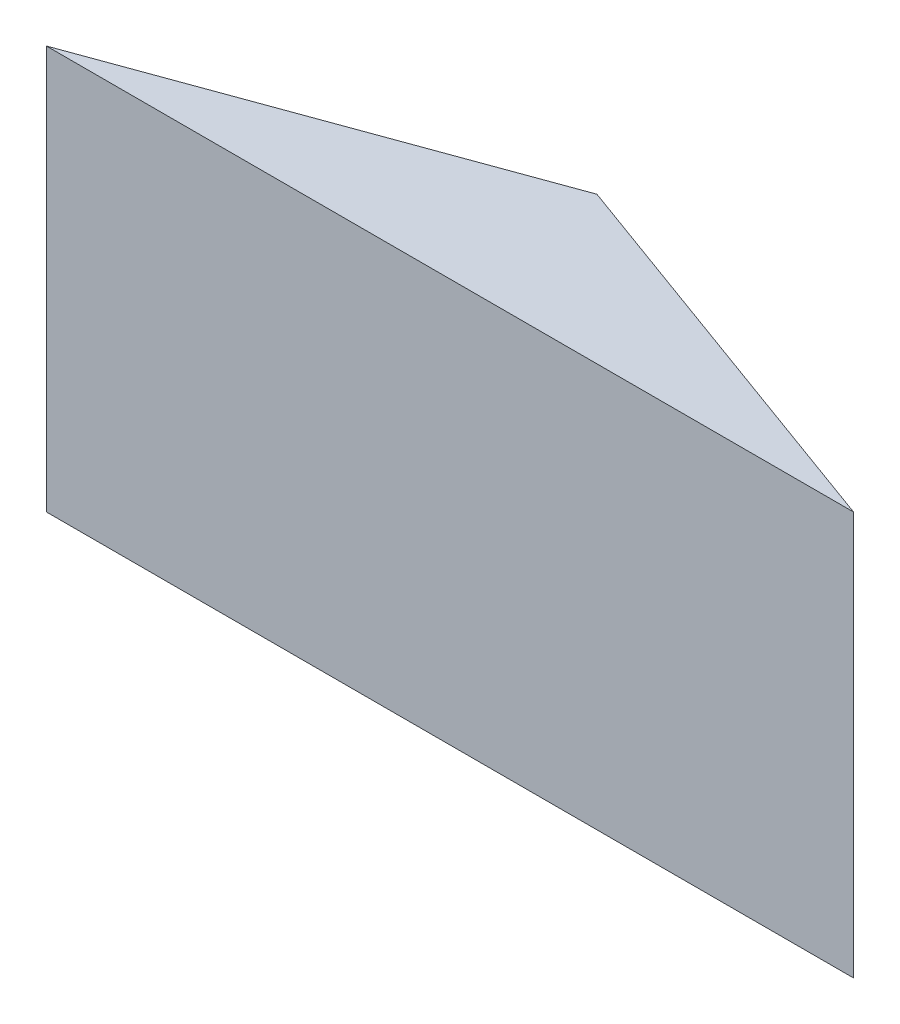
from build123d import *

# Parameters (mm, degrees)
BOSS_EXTRUDE1_DEPTH = 20


with BuildPart() as part:
    # Sketch1 → Boss-Extrude1 (new body)
    with BuildSketch(Plane(origin=(0, 0, 0), x_dir=(1, 0, 0), z_dir=(0, 1, 0))):
        Polygon((0, 7.279404685), (-20, 0), (0, 0), align=None)
        Polygon((0, 7.279404685), (0, 0), (20, 0), align=None)
    extrude(amount=BOSS_EXTRUDE1_DEPTH)


solid = part.part
